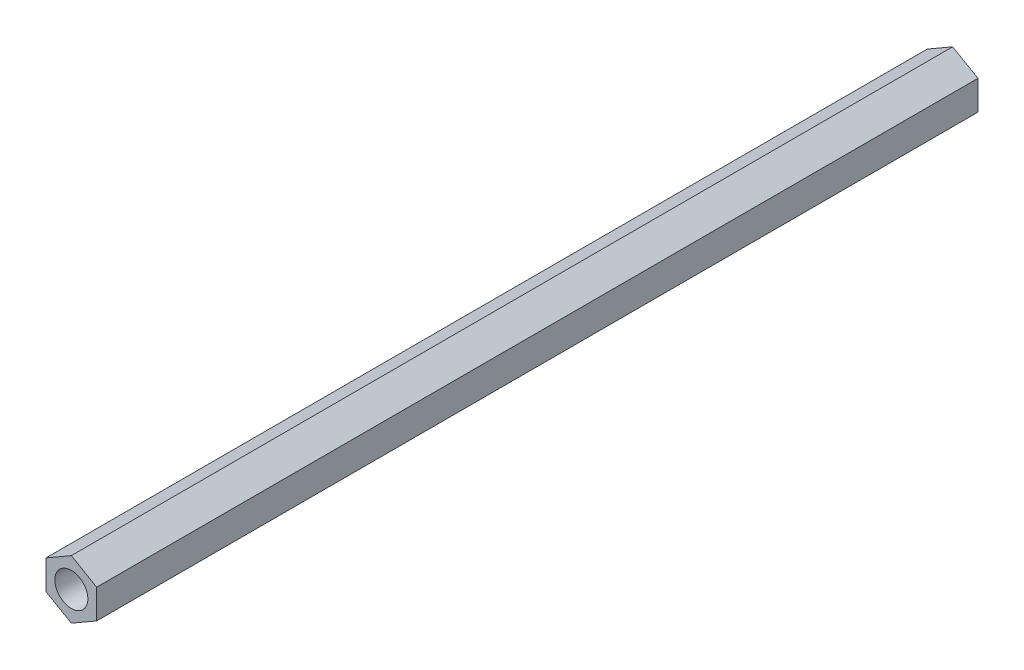
from build123d import *

# Parameters (mm, degrees)
SKETCH_1_R      = 1.5
EXTRUDE_1_DEPTH = 80


with BuildPart() as part:
    # 草图1 → 凸台-拉伸1 (new body)
    with BuildSketch(Plane.XY):
        Polygon((0, 2.655811238), (-2.3, 1.327905619), (-2.3, -1.327905619), (0, -2.655811238), (2.3, -1.327905619), (2.3, 1.327905619), align=None)
        Circle(SKETCH_1_R, mode=Mode.SUBTRACT)
    extrude(amount=EXTRUDE_1_DEPTH)


solid = part.part
